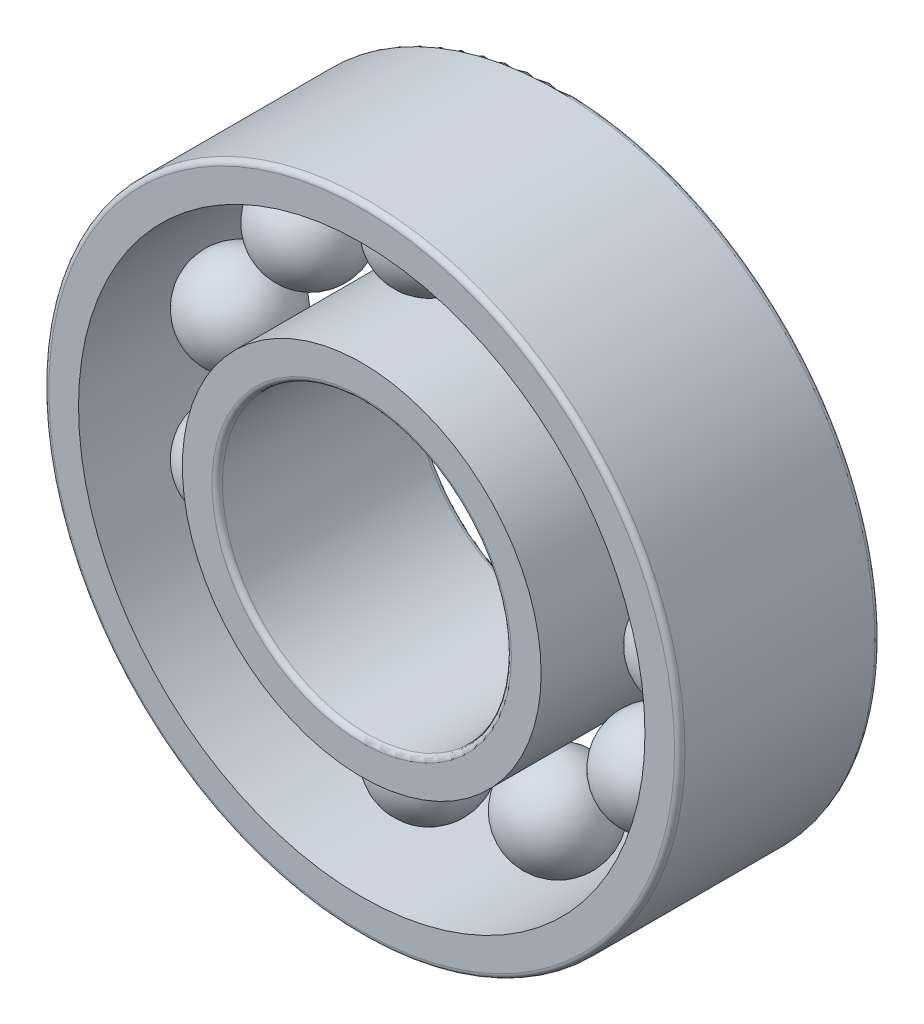
from build123d import *

# Parameters (mm, degrees)
INNERS_W           = 1.9125
INNERS_H           = 11
OUTERS_W           = 1.9125
OUTERS_H           = 11
BALLSPATTERN_COUNT = 11
FILLET_F1_R        = 0.28575
FILLET_F2_R        = 0.28575


with BuildPart() as part:
    # InnerS → InnerRing (revolve)
    with BuildSketch(Plane(origin=(0, 0, 0), x_dir=(1, 0, 0), z_dir=(0, 1, 0))):
        with Locations((8.89375, 0)):
            Rectangle(INNERS_W, INNERS_H)
    revolve(axis=Axis((0, 0, 9.25), (0, 0, -1)))

    # Fillet F2
    fillet_f2_edges = [part.edges().sort_by_distance(p)[0] for p in [
        (-7.9375, 0, -5.5),
        (-7.9375, 0, 5.5),
    ]]
    fillet(fillet_f2_edges, radius=FILLET_F2_R)


with BuildPart() as body_2:
    # OuterS → OuterRing (revolve)
    with BuildSketch(Plane(origin=(0, 0, 0), x_dir=(1, 0, 0), z_dir=(0, 1, 0))):
        with Locations((16.50625, 0)):
            Rectangle(OUTERS_W, OUTERS_H)
    revolve(axis=Axis((0, 0, 9.25), (0, 0, -1)))

    # Fillet F1
    fillet_f1_edges = [body_2.edges().sort_by_distance(p)[0] for p in [
        (-17.4625, 0, -5.5),
        (-17.4625, 0, 5.5),
    ]]
    fillet(fillet_f1_edges, radius=FILLET_F1_R)


with BuildPart() as body_3:
    # BallS → Ball (revolve)
    with BuildSketch(Plane(origin=(0, 0, 0), x_dir=(1, 0, 0), z_dir=(0, 1, 0))):
        with BuildLine():
            Line((9.9925, 0), (15.4075, 0))
            ThreePointArc((15.4075, 0), (12.7, -2.7075), (9.9925, 0))
        make_face()
    revolve(axis=Axis((9.9925, 0, 0), (1, 0, 0)))


with BuildPart() as ballspattern_1:
    # BallsPattern: pattern copy
    add(body_3.part.rotate(Axis((0, 0, -6.05), (0, 0, 1)), 1 * 360 / BALLSPATTERN_COUNT))


with BuildPart() as ballspattern_2:
    # BallsPattern: pattern copy
    add(body_3.part.rotate(Axis((0, 0, -6.05), (0, 0, 1)), 2 * 360 / BALLSPATTERN_COUNT))


with BuildPart() as ballspattern_3:
    # BallsPattern: pattern copy
    add(body_3.part.rotate(Axis((0, 0, -6.05), (0, 0, 1)), 3 * 360 / BALLSPATTERN_COUNT))


with BuildPart() as ballspattern_4:
    # BallsPattern: pattern copy
    add(body_3.part.rotate(Axis((0, 0, -6.05), (0, 0, 1)), 4 * 360 / BALLSPATTERN_COUNT))


with BuildPart() as ballspattern_5:
    # BallsPattern: pattern copy
    add(body_3.part.rotate(Axis((0, 0, -6.05), (0, 0, 1)), 5 * 360 / BALLSPATTERN_COUNT))


with BuildPart() as ballspattern_6:
    # BallsPattern: pattern copy
    add(body_3.part.rotate(Axis((0, 0, -6.05), (0, 0, 1)), 6 * 360 / BALLSPATTERN_COUNT))


with BuildPart() as ballspattern_7:
    # BallsPattern: pattern copy
    add(body_3.part.rotate(Axis((0, 0, -6.05), (0, 0, 1)), 7 * 360 / BALLSPATTERN_COUNT))


with BuildPart() as ballspattern_8:
    # BallsPattern: pattern copy
    add(body_3.part.rotate(Axis((0, 0, -6.05), (0, 0, 1)), 8 * 360 / BALLSPATTERN_COUNT))


with BuildPart() as ballspattern_9:
    # BallsPattern: pattern copy
    add(body_3.part.rotate(Axis((0, 0, -6.05), (0, 0, 1)), 9 * 360 / BALLSPATTERN_COUNT))


with BuildPart() as ballspattern_10:
    # BallsPattern: pattern copy
    add(body_3.part.rotate(Axis((0, 0, -6.05), (0, 0, 1)), 10 * 360 / BALLSPATTERN_COUNT))


solid = Compound([part.part, body_2.part, body_3.part, ballspattern_1.part, ballspattern_2.part, ballspattern_3.part, ballspattern_4.part, ballspattern_5.part, ballspattern_6.part, ballspattern_7.part, ballspattern_8.part, ballspattern_9.part, ballspattern_10.part])
